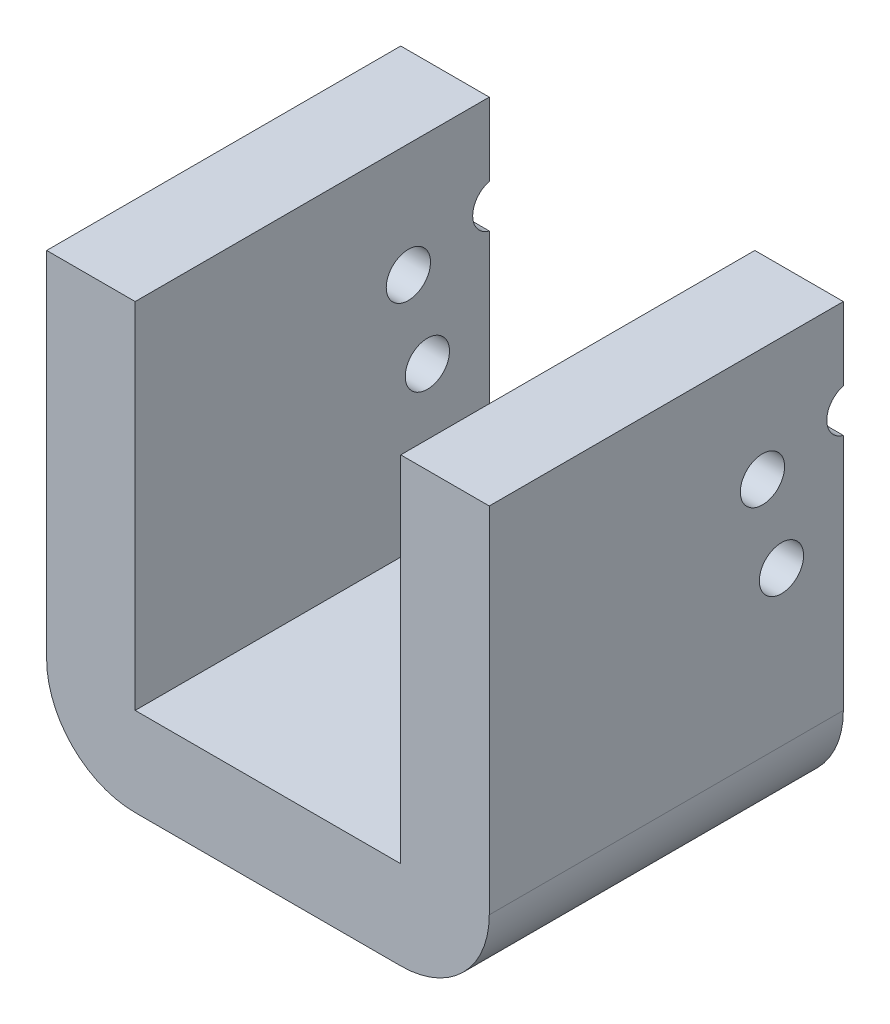
from build123d import *

# Parameters (mm, degrees)
RESSALTO_EXTRUS_O1_DEPTH = 40
FILETE1_R                = 10
ESBO_O3_R                = 2.5
CORTE_EXTRUS_O1_DEPTH    = 60


with BuildPart() as part:
    # Esboço1 → Ressalto-extrusão1 (new body)
    with BuildSketch(Plane.XY):
        Polygon((0, 0), (0, 50), (10, 50), (10, 10), (40, 10), (40, 50), (50, 50), (50, 0), align=None)
    extrude(amount=RESSALTO_EXTRUS_O1_DEPTH)

    # Filete1
    filete1_edges = [part.edges().sort_by_distance(p)[0] for p in [
        (0, 0, 20),
        (50, 0, 20),
    ]]
    fillet(filete1_edges, radius=FILETE1_R)

    # Esboço3 → Corte-extrusão1 (cut)
    with BuildSketch(Plane.ZY):
        with Locations((-0.627602125, 39.325673362)):
            Circle(ESBO_O3_R)
        with Locations((9.138766469, 37.17670978)):
            Circle(ESBO_O3_R)
        with Locations((6.989802887, 27.410341185)):
            Circle(ESBO_O3_R)
        with Locations((-2.776565708, 29.559304768)):
            Circle(ESBO_O3_R)
    extrude(amount=-CORTE_EXTRUS_O1_DEPTH, mode=Mode.SUBTRACT)


solid = part.part
